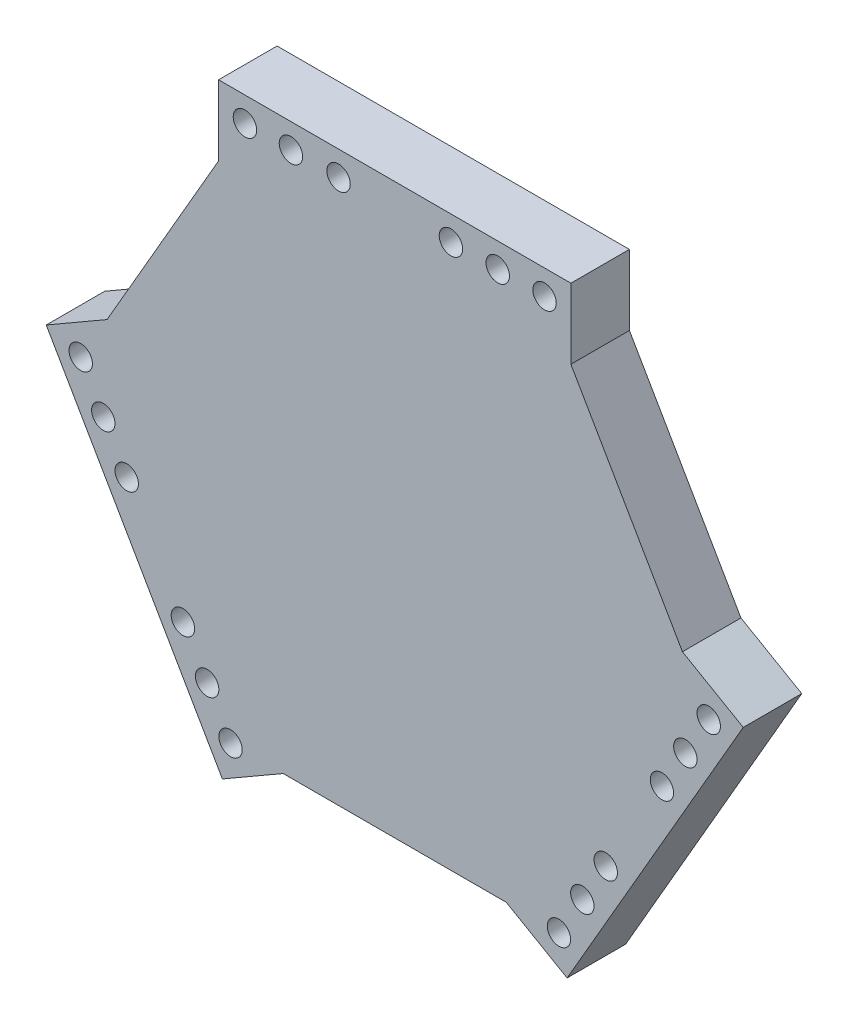
from build123d import *

# Parameters (mm, degrees)
EXTRUDE_4_DEPTH = 10


with BuildPart() as part:
    # 草圖1 → 填料-伸長4 (new body)
    with BuildSketch(Plane.XY):
        Polygon((49.802669845, 25.924393386), (-10.397330155, 25.924393386), (-29.457330155, -7.088495007), (0.642669845, -59.223224314), (38.762669845, -59.223224314), (68.862669845, -7.088495007), align=None)
        with BuildLine():
            Line((-0.037670798, 33.71862202), (-3.897330155, 33.71862202))
            ThreePointArc((-3.897330155, 33.71862202), (-4.897330155, 31.986571212), (-6.897330155, 31.986571212))
            Line((-6.897330155, 31.986571212), (-10.397330155, 25.924393386))
            Line((-10.397330155, 25.924393386), (49.802669845, 25.924393386))
            Line((49.802669845, 25.924393386), (46.302669845, 31.986571212))
            ThreePointArc((46.302669845, 31.986571212), (44.302669845, 31.986571212), (43.302669845, 33.71862202))
            Line((43.302669845, 33.71862202), (39.302669845, 33.71862202))
            ThreePointArc((39.302669845, 33.71862202), (37.302669845, 31.71862202), (35.302669845, 33.71862202))
            Line((35.302669845, 33.71862202), (31.302669845, 33.71862202))
            ThreePointArc((31.302669845, 33.71862202), (29.302669845, 31.71862202), (27.302669845, 33.71862202))
            Line((27.302669845, 33.71862202), (12.102669845, 33.71862202))
            ThreePointArc((12.102669845, 33.71862202), (10.102669845, 31.71862202), (8.102669845, 33.71862202))
            Line((8.102669845, 33.71862202), (3.962329202, 33.71862202))
            ThreePointArc((3.962329202, 33.71862202), (1.962329202, 31.71862202), (-0.037670798, 33.71862202))
        make_face()
        with BuildLine():
            ThreePointArc((-6.897330155, 31.986571212), (-6.897330155, 35.450672827), (-3.897330155, 33.71862202))
            Line((-3.897330155, 33.71862202), (-0.037670798, 33.71862202))
            ThreePointArc((-0.037670798, 33.71862202), (1.962329202, 35.71862202), (3.962329202, 33.71862202))
            Line((3.962329202, 33.71862202), (8.102669845, 33.71862202))
            ThreePointArc((8.102669845, 33.71862202), (10.102669845, 35.71862202), (12.102669845, 33.71862202))
            Line((12.102669845, 33.71862202), (27.302669845, 33.71862202))
            ThreePointArc((27.302669845, 33.71862202), (29.302669845, 35.71862202), (31.302669845, 33.71862202))
            Line((31.302669845, 33.71862202), (35.302669845, 33.71862202))
            ThreePointArc((35.302669845, 33.71862202), (37.302669845, 35.71862202), (39.302669845, 33.71862202))
            Line((39.302669845, 33.71862202), (43.302669845, 33.71862202))
            ThreePointArc((43.302669845, 33.71862202), (45.302669845, 35.71862202), (47.302669845, 33.71862202))
            ThreePointArc((47.302669845, 33.71862202), (47.034720652, 32.71862202), (46.302669845, 31.986571212))
            Line((46.302669845, 31.986571212), (49.802669845, 25.924393386))
            Line((49.802669845, 25.924393386), (49.802669845, 37.924393386))
            Line((49.802669845, 37.924393386), (-10.397330155, 37.924393386))
            Line((-10.397330155, 37.924393386), (-10.397330155, 25.924393386))
            Line((-10.397330155, 25.924393386), (-6.897330155, 31.986571212))
        make_face()
        with BuildLine():
            Line((-32.957330155, -13.150672833), (-29.457330155, -7.088495007))
            Line((-29.457330155, -7.088495007), (-39.849635001, -13.088495007))
            Line((-39.849635001, -13.088495007), (-9.749635001, -65.223224314))
            Line((-9.749635001, -65.223224314), (0.642669845, -59.223224314))
            Line((0.642669845, -59.223224314), (-6.357330155, -59.223224314))
            ThreePointArc((-6.357330155, -59.223224314), (-9.357330155, -60.955275122), (-9.357330155, -57.491173507))
            Line((-9.357330155, -57.491173507), (-11.357330155, -54.027071892))
            ThreePointArc((-11.357330155, -54.027071892), (-14.089380963, -53.295021084), (-13.357330155, -50.562970277))
            Line((-13.357330155, -50.562970277), (-15.394263476, -47.034898273))
            ThreePointArc((-15.394263476, -47.034898273), (-18.229721605, -46.366817854), (-17.390567155, -43.577198874))
            Line((-17.390567155, -43.577198874), (-24.994263476, -30.40721052))
            ThreePointArc((-24.994263476, -30.40721052), (-27.829721605, -29.739130101), (-26.990567155, -26.949511121))
            Line((-26.990567155, -26.949511121), (-28.994263476, -23.47900729))
            ThreePointArc((-28.994263476, -23.47900729), (-31.829721605, -22.810926871), (-30.990567155, -20.021307891))
            Line((-30.990567155, -20.021307891), (-32.957330155, -16.614774448))
            ThreePointArc((-32.957330155, -16.614774448), (-35.957330155, -14.882723641), (-32.957330155, -13.150672833))
        make_face()
        with BuildLine():
            Line((0.642669845, -59.223224314), (-29.457330155, -7.088495007))
            Line((-29.457330155, -7.088495007), (-32.957330155, -13.150672833))
            ThreePointArc((-32.957330155, -13.150672833), (-32.225279348, -13.882723641), (-31.957330155, -14.882723641))
            ThreePointArc((-31.957330155, -14.882723641), (-32.225279348, -15.882723641), (-32.957330155, -16.614774448))
            Line((-32.957330155, -16.614774448), (-30.990567155, -20.021307891))
            ThreePointArc((-30.990567155, -20.021307891), (-29.045480871, -20.110075214), (-28.097670798, -21.810926871))
            ThreePointArc((-28.097670798, -21.810926871), (-28.336021763, -22.75781265), (-28.994263476, -23.47900729))
            Line((-28.994263476, -23.47900729), (-26.990567155, -26.949511121))
            ThreePointArc((-26.990567155, -26.949511121), (-25.045480871, -27.038278445), (-24.097670798, -28.739130101))
            ThreePointArc((-24.097670798, -28.739130101), (-24.336021763, -29.68601588), (-24.994263476, -30.40721052))
            Line((-24.994263476, -30.40721052), (-17.390567155, -43.577198874))
            ThreePointArc((-17.390567155, -43.577198874), (-15.445480871, -43.665966197), (-14.497670798, -45.366817854))
            ThreePointArc((-14.497670798, -45.366817854), (-14.736021763, -46.313703633), (-15.394263476, -47.034898273))
            Line((-15.394263476, -47.034898273), (-13.357330155, -50.562970277))
            ThreePointArc((-13.357330155, -50.562970277), (-11.357330155, -50.562970277), (-10.357330155, -52.295021084))
            ThreePointArc((-10.357330155, -52.295021084), (-10.625279348, -53.295021084), (-11.357330155, -54.027071892))
            Line((-11.357330155, -54.027071892), (-9.357330155, -57.491173507))
            ThreePointArc((-9.357330155, -57.491173507), (-7.357330155, -57.491173507), (-6.357330155, -59.223224314))
            Line((-6.357330155, -59.223224314), (0.642669845, -59.223224314))
        make_face()
        with BuildLine():
            Line((79.25497469, -13.088495007), (68.862669845, -7.088495007))
            Line((68.862669845, -7.088495007), (72.362669845, -13.150672833))
            ThreePointArc((72.362669845, -13.150672833), (74.362669845, -13.150672833), (75.362669845, -14.882723641))
            ThreePointArc((75.362669845, -14.882723641), (74.362669845, -16.614774448), (72.362669845, -16.614774448))
            Line((72.362669845, -16.614774448), (70.362669845, -20.078876063))
            ThreePointArc((70.362669845, -20.078876063), (71.094720652, -20.810926871), (71.362669845, -21.810926871))
            ThreePointArc((71.362669845, -21.810926871), (70.362669845, -23.542977679), (68.362669845, -23.542977679))
            Line((68.362669845, -23.542977679), (66.362669845, -27.007079294))
            ThreePointArc((66.362669845, -27.007079294), (67.094720652, -27.739130101), (67.362669845, -28.739130101))
            ThreePointArc((67.362669845, -28.739130101), (66.362669845, -30.471180909), (64.362669845, -30.471180909))
            Line((64.362669845, -30.471180909), (56.762669845, -43.634767046))
            ThreePointArc((56.762669845, -43.634767046), (57.494720652, -44.366817854), (57.762669845, -45.366817854))
            ThreePointArc((57.762669845, -45.366817854), (56.762669845, -47.098868661), (54.762669845, -47.098868661))
            Line((54.762669845, -47.098868661), (52.762669845, -50.562970277))
            ThreePointArc((52.762669845, -50.562970277), (53.494720652, -51.295021084), (53.762669845, -52.295021084))
            ThreePointArc((53.762669845, -52.295021084), (52.762669845, -54.027071892), (50.762669845, -54.027071892))
            Line((50.762669845, -54.027071892), (48.762669845, -57.491173507))
            ThreePointArc((48.762669845, -57.491173507), (49.494720652, -58.223224314), (49.762669845, -59.223224314))
            ThreePointArc((49.762669845, -59.223224314), (47.762669845, -61.223224314), (45.762669845, -59.223224314))
            Line((45.762669845, -59.223224314), (38.762669845, -59.223224314))
            Line((38.762669845, -59.223224314), (49.15497469, -65.223224314))
            Line((49.15497469, -65.223224314), (79.25497469, -13.088495007))
        make_face()
        with BuildLine():
            Line((72.362669845, -13.150672833), (68.862669845, -7.088495007))
            Line((68.862669845, -7.088495007), (38.762669845, -59.223224314))
            Line((38.762669845, -59.223224314), (45.762669845, -59.223224314))
            ThreePointArc((45.762669845, -59.223224314), (46.762669845, -57.491173507), (48.762669845, -57.491173507))
            Line((48.762669845, -57.491173507), (50.762669845, -54.027071892))
            ThreePointArc((50.762669845, -54.027071892), (50.030619037, -51.295021084), (52.762669845, -50.562970277))
            Line((52.762669845, -50.562970277), (54.762669845, -47.098868661))
            ThreePointArc((54.762669845, -47.098868661), (54.030619037, -44.366817854), (56.762669845, -43.634767046))
            Line((56.762669845, -43.634767046), (64.362669845, -30.471180909))
            ThreePointArc((64.362669845, -30.471180909), (63.630619037, -27.739130101), (66.362669845, -27.007079294))
            Line((66.362669845, -27.007079294), (68.362669845, -23.542977679))
            ThreePointArc((68.362669845, -23.542977679), (67.630619037, -20.810926871), (70.362669845, -20.078876063))
            Line((70.362669845, -20.078876063), (72.362669845, -16.614774448))
            ThreePointArc((72.362669845, -16.614774448), (71.362669845, -14.882723641), (72.362669845, -13.150672833))
        make_face()
    extrude(amount=EXTRUDE_4_DEPTH)


solid = part.part
